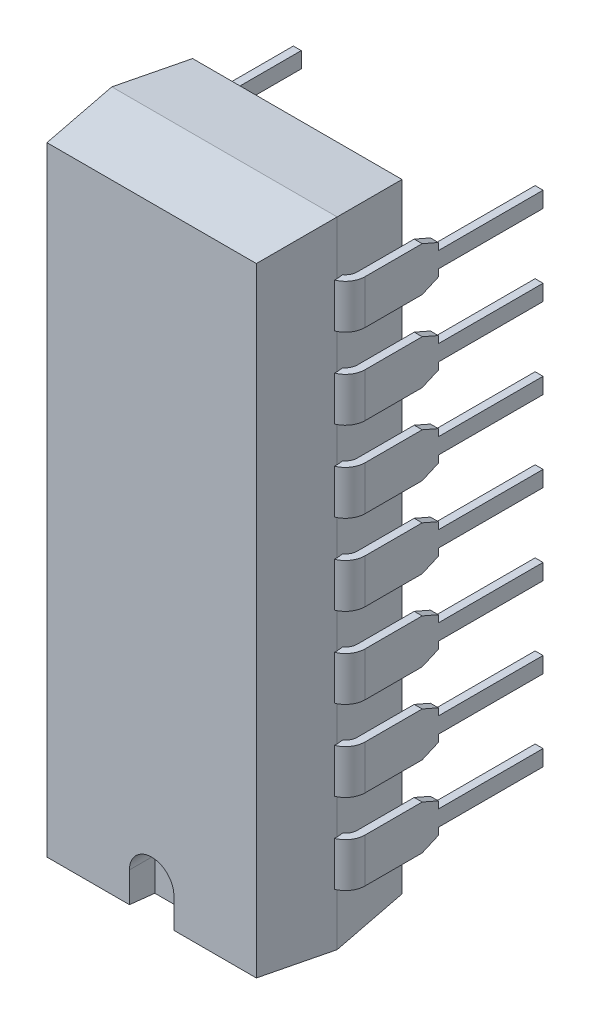
from build123d import *

# Parameters (mm, degrees)
BASIC_SHAPE_DEPTH          = 10
SIDE_PROFILE1_DEPTH        = 12.773380993
SIDE_PROFILE1_DEPTH_BACK   = 12.773380993
SIDE_PROFILE2_DEPTH        = 12.773380993
SIDE_PROFILE2_DEPTH_BACK   = 12.773380993
LOCATION_MARK_DEPTH        = 0.8
SKETCH6_W                  = 0.25
SKETCH6_H                  = 1.39
PIN_RELIEF_DEPTH           = 14.354970049
UPPER_PINS_COUNT           = 4
UPPER_PINS_PITCH           = 2.54
UPPER_PINS_COPY_1_SKETCH_W = 0.25
UPPER_PINS_COPY_1_SKETCH_H = 1.39
UPPER_PINS_COPY_2_SKETCH_W = 0.25
UPPER_PINS_COPY_2_SKETCH_H = 1.39
UPPER_PINS_COPY_3_SKETCH_W = 0.25
UPPER_PINS_COPY_3_SKETCH_H = 1.39
UPPER_PINS_COPY_4_DEPTH    = 14.354970049
UPPER_PINS_COPY_5_DEPTH    = 14.354970049
UPPER_PINS_COPY_6_DEPTH    = 14.354970049
LOWER_PINS_COUNT           = 4
LOWER_PINS_PITCH           = 2.54
LOWER_PINS_COPY_1_SKETCH_W = 0.25
LOWER_PINS_COPY_1_SKETCH_H = 1.39
LOWER_PINS_COPY_2_SKETCH_W = 0.25
LOWER_PINS_COPY_2_SKETCH_H = 1.39
LOWER_PINS_COPY_3_SKETCH_W = 0.25
LOWER_PINS_COPY_3_SKETCH_H = 1.39
LOWER_PINS_COPY_4_DEPTH    = 14.354970049
LOWER_PINS_COPY_5_DEPTH    = 14.354970049
LOWER_PINS_COPY_6_DEPTH    = 14.354970049


with BuildPart() as part:
    # Sketch1 → Basic Shape (new, symmetric)
    with BuildSketch(Plane(origin=(0, 0, 0), x_dir=(1, 0, 0), z_dir=(0, 1, 0))):
        Polygon((-3.3, -5.1), (-3.55, -2.805), (-3.3, -0.51), (3.3, -0.51), (3.55, -2.805), (3.3, -5.1), align=None)
    extrude(amount=BASIC_SHAPE_DEPTH, both=True)

    # Sketch2 → Side Profile1 (cut, two sides: drawn at the far end of the back side and taken through both)
    with BuildSketch(Plane(origin=(0, 0, 0), x_dir=(0, 0, -1), z_dir=(1, 0, 0)).offset(-SIDE_PROFILE1_DEPTH_BACK)):
        Polygon((-0.51, 10), (-0.51, 9.75), (-2.805, 10), align=None)
        Polygon((-0.51, -10), (-2.805, -10), (-0.51, -9.75), align=None)
    extrude(amount=SIDE_PROFILE1_DEPTH + SIDE_PROFILE1_DEPTH_BACK, mode=Mode.SUBTRACT)

    # Sketch3 → Side Profile2 (cut, two sides: drawn at the far end of the back side and taken through both)
    with BuildSketch(Plane(origin=(0, 0, 0), x_dir=(0, 0, -1), z_dir=(1, 0, 0)).offset(-SIDE_PROFILE2_DEPTH_BACK)):
        Polygon((-2.805, 10), (-5.1, 10), (-5.1, 9.75), align=None)
        Polygon((-2.805, -10), (-5.1, -10), (-5.1, -9.75), align=None)
    extrude(amount=SIDE_PROFILE2_DEPTH + SIDE_PROFILE2_DEPTH_BACK, mode=Mode.SUBTRACT)

    # Sketch4 → Location Mark (cut)
    with BuildSketch(Plane.XY.offset(5.1)):
        with BuildLine():
            Line((-0.7, -10), (-0.7, -8.8))
            ThreePointArc((-0.7, -8.8), (0, -8.1), (0.7, -8.8))
            Line((0.7, -8.8), (0.7, -10))
            Line((0.7, -10), (-0.7, -10))
        make_face()
    extrude(amount=-LOCATION_MARK_DEPTH, mode=Mode.SUBTRACT)

    # Central Pin: sweep along a path in Sketch5
    with BuildLine(Plane(origin=(0, 0, 0), x_dir=(1, 0, 0), z_dir=(0, 1, 0))) as central_pin_path:
        Line((0, -2.805), (3.31, -2.805))
        ThreePointArc((3.31, -2.805), (3.663553391, -2.658553391), (3.81, -2.305))
        Line((3.81, -2.305), (3.81, 3.3))
    # Sketch6 → Central Pin (sweep)
    with BuildSketch(Plane(origin=(0, 0, 0), x_dir=(0, 0, -1), z_dir=(1, 0, 0))):
        with Locations((-2.805, 0)):
            Rectangle(SKETCH6_W, SKETCH6_H)
    central_pin = sweep(path=central_pin_path.line)

    # Sketch7 → Pin Relief (cut, through all)
    with BuildSketch(Plane.ZY.offset(-3.685)):
        Polygon((-3.3, -0.25), (0, -0.25), (0, -0.4725), (0.51, -0.695), (-3.3, -0.695), align=None)
        Polygon((-3.3, 0.25), (0, 0.25), (0, 0.4725), (0.51, 0.695), (-3.3, 0.695), align=None)
    pin_relief = extrude(amount=-PIN_RELIEF_DEPTH, mode=Mode.SUBTRACT)

    # Opp Pin: Central Pin, Pin Relief across plane
    add(central_pin.mirror(Plane(origin=(0, 0, 0), x_dir=(0, 0, 1), z_dir=(1, 0, 0))))
    add(pin_relief.mirror(Plane(origin=(0, 0, 0), x_dir=(0, 0, 1), z_dir=(1, 0, 0))), mode=Mode.SUBTRACT)

    # Upper Pins: Central Pin, Pin Relief ×4
    with Locations(*[(0, -i * UPPER_PINS_PITCH, 0) for i in range(1, UPPER_PINS_COUNT)]):
        add(central_pin)
        add(pin_relief, mode=Mode.SUBTRACT)

    # Upper Pins copy 1: sweep along a path in Upper Pins copy 1 path
    with BuildLine(Plane(origin=(0, -2.54, 0), x_dir=(-1, 0, 0), z_dir=(0, 1, 0))) as upper_pins_copy_1_path:
        Line((0, 2.805), (3.31, 2.805))
        ThreePointArc((3.31, 2.805), (3.663553391, 2.658553391), (3.81, 2.305))
        Line((3.81, 2.305), (3.81, -3.3))
    # Upper Pins copy 1 sketch → Upper Pins copy 1 (sweep)
    with BuildSketch(Plane(origin=(0, -2.54, 0), x_dir=(0, 0, -1), z_dir=(-1, 0, 0))):
        with Locations((-2.805, 0)):
            Rectangle(UPPER_PINS_COPY_1_SKETCH_W, UPPER_PINS_COPY_1_SKETCH_H)
    sweep(path=upper_pins_copy_1_path.line)

    # Upper Pins copy 2: sweep along a path in Upper Pins copy 2 path
    with BuildLine(Plane(origin=(0, -5.08, 0), x_dir=(-1, 0, 0), z_dir=(0, 1, 0))) as upper_pins_copy_2_path:
        Line((0, 2.805), (3.31, 2.805))
        ThreePointArc((3.31, 2.805), (3.663553391, 2.658553391), (3.81, 2.305))
        Line((3.81, 2.305), (3.81, -3.3))
    # Upper Pins copy 2 sketch → Upper Pins copy 2 (sweep)
    with BuildSketch(Plane(origin=(0, -5.08, 0), x_dir=(0, 0, -1), z_dir=(-1, 0, 0))):
        with Locations((-2.805, 0)):
            Rectangle(UPPER_PINS_COPY_2_SKETCH_W, UPPER_PINS_COPY_2_SKETCH_H)
    sweep(path=upper_pins_copy_2_path.line)

    # Upper Pins copy 3: sweep along a path in Upper Pins copy 3 path
    with BuildLine(Plane(origin=(0, -7.62, 0), x_dir=(-1, 0, 0), z_dir=(0, 1, 0))) as upper_pins_copy_3_path:
        Line((0, 2.805), (3.31, 2.805))
        ThreePointArc((3.31, 2.805), (3.663553391, 2.658553391), (3.81, 2.305))
        Line((3.81, 2.305), (3.81, -3.3))
    # Upper Pins copy 3 sketch → Upper Pins copy 3 (sweep)
    with BuildSketch(Plane(origin=(0, -7.62, 0), x_dir=(0, 0, -1), z_dir=(-1, 0, 0))):
        with Locations((-2.805, 0)):
            Rectangle(UPPER_PINS_COPY_3_SKETCH_W, UPPER_PINS_COPY_3_SKETCH_H)
    sweep(path=upper_pins_copy_3_path.line)

    # Upper Pins copy 4 sketch → Upper Pins copy 4 (cut, through all)
    with BuildSketch(Plane(origin=(-3.685, -2.54, 0), x_dir=(0, 0, 1), z_dir=(1, 0, 0))):
        Polygon((-3.3, 0.25), (0, 0.25), (0, 0.4725), (0.51, 0.695), (-3.3, 0.695), align=None)
        Polygon((-3.3, -0.25), (0, -0.25), (0, -0.4725), (0.51, -0.695), (-3.3, -0.695), align=None)
    extrude(amount=-UPPER_PINS_COPY_4_DEPTH, mode=Mode.SUBTRACT)

    # Upper Pins copy 5 sketch → Upper Pins copy 5 (cut, through all)
    with BuildSketch(Plane(origin=(-3.685, -5.08, 0), x_dir=(0, 0, 1), z_dir=(1, 0, 0))):
        Polygon((-3.3, 0.25), (0, 0.25), (0, 0.4725), (0.51, 0.695), (-3.3, 0.695), align=None)
        Polygon((-3.3, -0.25), (0, -0.25), (0, -0.4725), (0.51, -0.695), (-3.3, -0.695), align=None)
    extrude(amount=-UPPER_PINS_COPY_5_DEPTH, mode=Mode.SUBTRACT)

    # Upper Pins copy 6 sketch → Upper Pins copy 6 (cut, through all)
    with BuildSketch(Plane(origin=(-3.685, -7.62, 0), x_dir=(0, 0, 1), z_dir=(1, 0, 0))):
        Polygon((-3.3, 0.25), (0, 0.25), (0, 0.4725), (0.51, 0.695), (-3.3, 0.695), align=None)
        Polygon((-3.3, -0.25), (0, -0.25), (0, -0.4725), (0.51, -0.695), (-3.3, -0.695), align=None)
    extrude(amount=-UPPER_PINS_COPY_6_DEPTH, mode=Mode.SUBTRACT)

    # Lower Pins: Central Pin, Pin Relief ×4
    with Locations(*[(0, i * LOWER_PINS_PITCH, 0) for i in range(1, LOWER_PINS_COUNT)]):
        add(central_pin)
        add(pin_relief, mode=Mode.SUBTRACT)

    # Lower Pins copy 1: sweep along a path in Lower Pins copy 1 path
    with BuildLine(Plane(origin=(0, 2.54, 0), x_dir=(-1, 0, 0), z_dir=(0, 1, 0))) as lower_pins_copy_1_path:
        Line((0, 2.805), (3.31, 2.805))
        ThreePointArc((3.31, 2.805), (3.663553391, 2.658553391), (3.81, 2.305))
        Line((3.81, 2.305), (3.81, -3.3))
    # Lower Pins copy 1 sketch → Lower Pins copy 1 (sweep)
    with BuildSketch(Plane(origin=(0, 2.54, 0), x_dir=(0, 0, -1), z_dir=(-1, 0, 0))):
        with Locations((-2.805, 0)):
            Rectangle(LOWER_PINS_COPY_1_SKETCH_W, LOWER_PINS_COPY_1_SKETCH_H)
    sweep(path=lower_pins_copy_1_path.line)

    # Lower Pins copy 2: sweep along a path in Lower Pins copy 2 path
    with BuildLine(Plane(origin=(0, 5.08, 0), x_dir=(-1, 0, 0), z_dir=(0, 1, 0))) as lower_pins_copy_2_path:
        Line((0, 2.805), (3.31, 2.805))
        ThreePointArc((3.31, 2.805), (3.663553391, 2.658553391), (3.81, 2.305))
        Line((3.81, 2.305), (3.81, -3.3))
    # Lower Pins copy 2 sketch → Lower Pins copy 2 (sweep)
    with BuildSketch(Plane(origin=(0, 5.08, 0), x_dir=(0, 0, -1), z_dir=(-1, 0, 0))):
        with Locations((-2.805, 0)):
            Rectangle(LOWER_PINS_COPY_2_SKETCH_W, LOWER_PINS_COPY_2_SKETCH_H)
    sweep(path=lower_pins_copy_2_path.line)

    # Lower Pins copy 3: sweep along a path in Lower Pins copy 3 path
    with BuildLine(Plane(origin=(0, 7.62, 0), x_dir=(-1, 0, 0), z_dir=(0, 1, 0))) as lower_pins_copy_3_path:
        Line((0, 2.805), (3.31, 2.805))
        ThreePointArc((3.31, 2.805), (3.663553391, 2.658553391), (3.81, 2.305))
        Line((3.81, 2.305), (3.81, -3.3))
    # Lower Pins copy 3 sketch → Lower Pins copy 3 (sweep)
    with BuildSketch(Plane(origin=(0, 7.62, 0), x_dir=(0, 0, -1), z_dir=(-1, 0, 0))):
        with Locations((-2.805, 0)):
            Rectangle(LOWER_PINS_COPY_3_SKETCH_W, LOWER_PINS_COPY_3_SKETCH_H)
    sweep(path=lower_pins_copy_3_path.line)

    # Lower Pins copy 4 sketch → Lower Pins copy 4 (cut, through all)
    with BuildSketch(Plane(origin=(-3.685, 2.54, 0), x_dir=(0, 0, 1), z_dir=(1, 0, 0))):
        Polygon((-3.3, 0.25), (0, 0.25), (0, 0.4725), (0.51, 0.695), (-3.3, 0.695), align=None)
        Polygon((-3.3, -0.25), (0, -0.25), (0, -0.4725), (0.51, -0.695), (-3.3, -0.695), align=None)
    extrude(amount=-LOWER_PINS_COPY_4_DEPTH, mode=Mode.SUBTRACT)

    # Lower Pins copy 5 sketch → Lower Pins copy 5 (cut, through all)
    with BuildSketch(Plane(origin=(-3.685, 5.08, 0), x_dir=(0, 0, 1), z_dir=(1, 0, 0))):
        Polygon((-3.3, 0.25), (0, 0.25), (0, 0.4725), (0.51, 0.695), (-3.3, 0.695), align=None)
        Polygon((-3.3, -0.25), (0, -0.25), (0, -0.4725), (0.51, -0.695), (-3.3, -0.695), align=None)
    extrude(amount=-LOWER_PINS_COPY_5_DEPTH, mode=Mode.SUBTRACT)

    # Lower Pins copy 6 sketch → Lower Pins copy 6 (cut, through all)
    with BuildSketch(Plane(origin=(-3.685, 7.62, 0), x_dir=(0, 0, 1), z_dir=(1, 0, 0))):
        Polygon((-3.3, 0.25), (0, 0.25), (0, 0.4725), (0.51, 0.695), (-3.3, 0.695), align=None)
        Polygon((-3.3, -0.25), (0, -0.25), (0, -0.4725), (0.51, -0.695), (-3.3, -0.695), align=None)
    extrude(amount=-LOWER_PINS_COPY_6_DEPTH, mode=Mode.SUBTRACT)


solid = part.part
